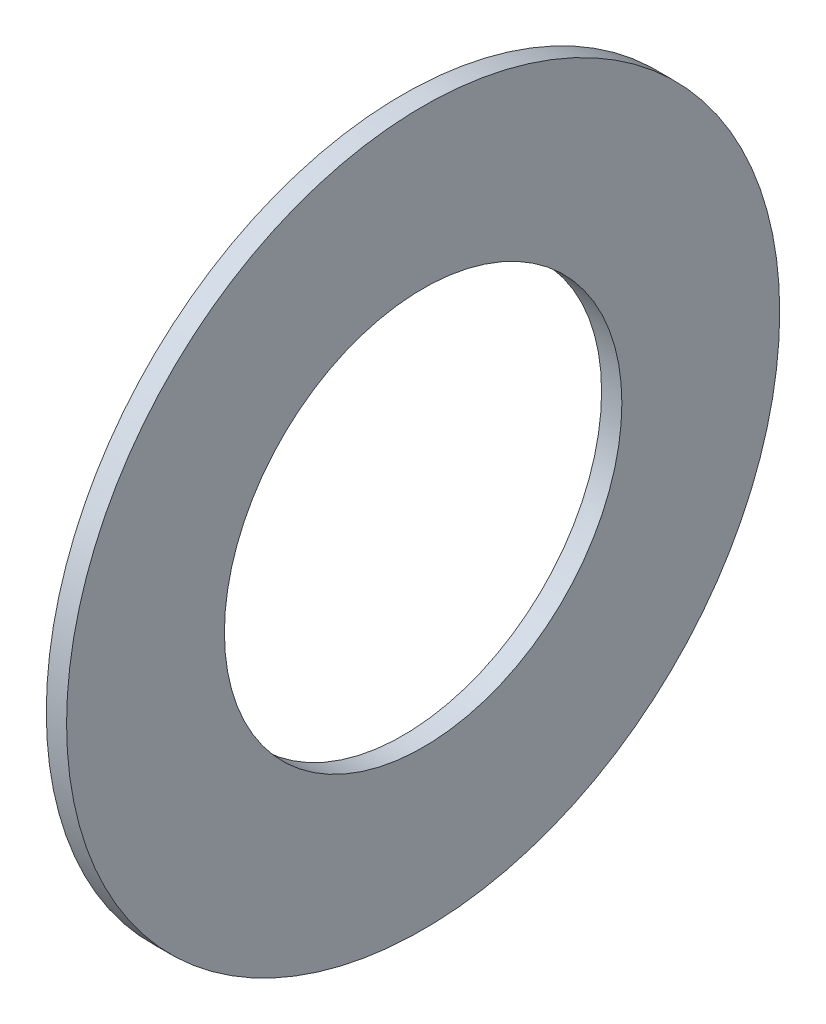
from build123d import *

# Parameters (mm, degrees)
SKETCH5_R           = 14.2875
SKETCH5_R_2         = 7.9629
BOSS_EXTRUDE1_DEPTH = 0.4064


with BuildPart() as part:
    # Sketch5 → Boss-Extrude1 (new, symmetric)
    with BuildSketch(Plane(origin=(0, 0, 0), x_dir=(0, 0, -1), z_dir=(1, 0, 0))):
        Circle(SKETCH5_R)
        Circle(SKETCH5_R_2, mode=Mode.SUBTRACT)
    extrude(amount=BOSS_EXTRUDE1_DEPTH, both=True)


solid = part.part
